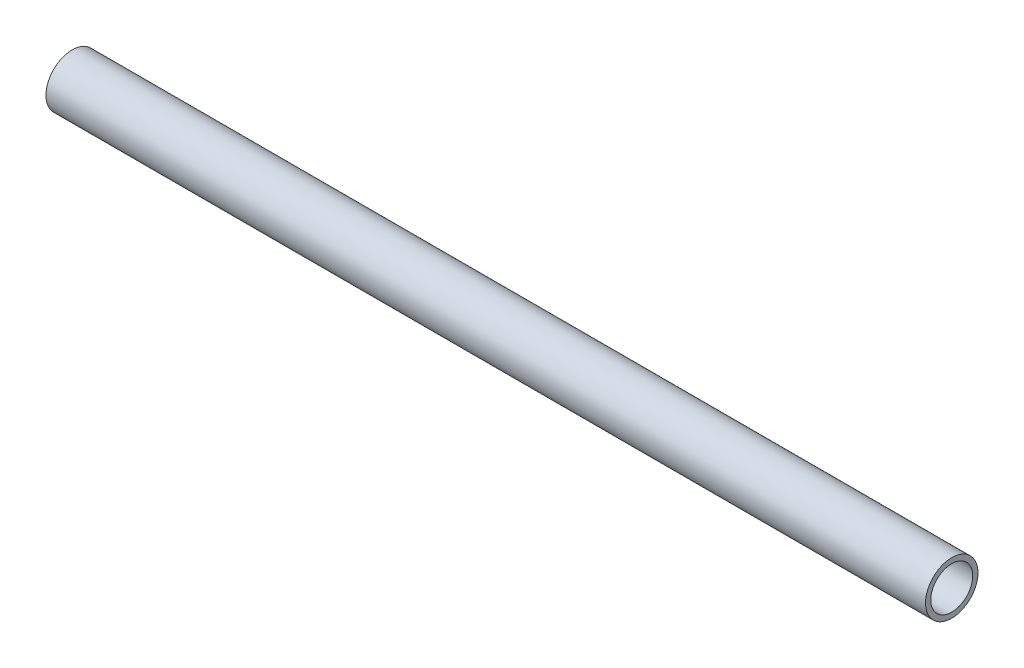
from build123d import *

# Parameters (mm, degrees)
SWEEP_THIN1_PROFILE_R   = 10
SWEEP_THIN1_PROFILE_R_2 = 8


with BuildPart() as part:
    # Sweep-Thin1: sweep along a path in Sketch1
    with BuildLine(Plane.XY) as sweep_thin1_path:
        Line((-179.381625442, -10.66254417), (155.618374558, -10.66254417))
    # Sweep-Thin1 profile (on start of the path) → Sweep-Thin1 (sweep)
    with BuildSketch(Plane(origin=(-179.381625442, -10.66254417, 0), x_dir=(0, 0, 1), z_dir=(1, 0, 0))):
        Circle(SWEEP_THIN1_PROFILE_R)
        Circle(SWEEP_THIN1_PROFILE_R_2, mode=Mode.SUBTRACT)
    sweep(path=sweep_thin1_path.line)


solid = part.part
